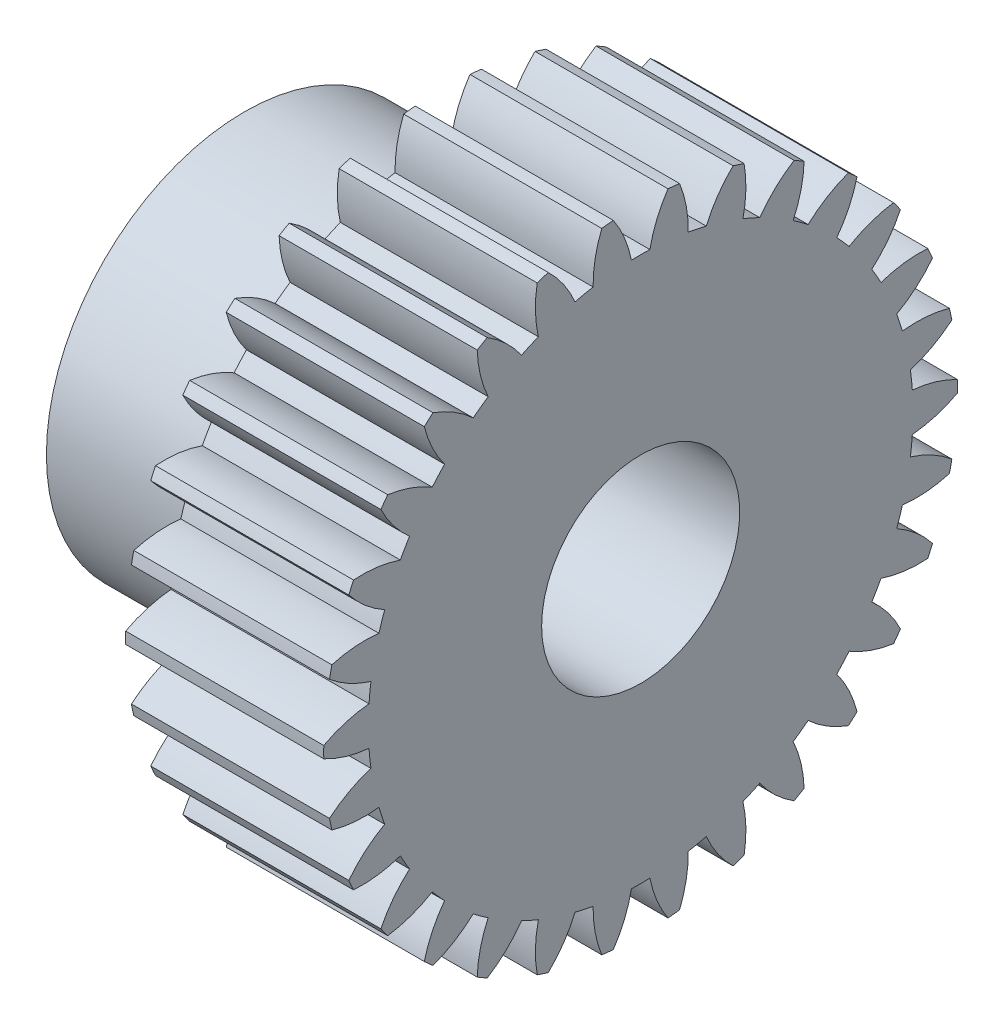
from build123d import *

# Parameters (mm, degrees)
BASPROSKE_W      = 5
BASPROSKE_H      = 8
TOOTHCUT_DEPTH   = 13.369316877
TEETHCUTS_COUNT  = 30
TEETHCUTS_ANGLE  = 348
HUBNEAONESKE_R   = 5
HUBNEARONE_DEPTH = 5.0000508
BORSKE_R         = 2.5
BORE_DEPTH       = 10.0000508


with BuildPart() as part:
    # BasProSke → Base-Revolve (revolve)
    with BuildSketch(Plane(origin=(0, 0, 0), x_dir=(1, 0, 0), z_dir=(0, 1, 0)), mode=Mode.PRIVATE) as base_revolve_sk:
        with Locations((2.5, 4)):
            Rectangle(BASPROSKE_W, BASPROSKE_H)
    revolve(base_revolve_sk.sketch.rotate(Axis((-10, 0, 0), (1, 0, 0)), 180), axis=Axis((-10, 0, 0), (1, 0, 0)))

    # TooCutSke → ToothCut (cut, through all)
    with BuildSketch(Plane(origin=(0, 0, 0), x_dir=(0, 0, -1), z_dir=(1, 0, 0))):
        with BuildLine():
            ThreePointArc((0.233102578, 6.87004652), (0, 6.874), (-0.233102578, 6.87004652))
            ThreePointArc((-0.233102578, 6.87004652), (-0.41229689, 7.456465027), (-0.706981715, 7.994199273))
            ThreePointArc((-0.706981715, 7.994199273), (0, 8.0254), (0.706981715, 7.994199273))
            ThreePointArc((0.706981715, 7.994199273), (0.41229689, 7.456465027), (0.233102578, 6.87004652))
        make_face()
    toothcut = extrude(amount=TOOTHCUT_DEPTH, mode=Mode.SUBTRACT)

    # TeethCuts: ToothCut ×30 about axis
    teethcuts_axis = Axis((-10, 0, 0), (1, 0, 0))
    for i in range(1, TEETHCUTS_COUNT):
        add(toothcut.rotate(teethcuts_axis, i * TEETHCUTS_ANGLE / (TEETHCUTS_COUNT - 1)), mode=Mode.SUBTRACT)

    # HubNeaOneSke → HubNearOne (add)
    with BuildSketch(Plane.ZY):
        with Locations(Location((0, 0, 0), (0, 0, 180))):
            Circle(HUBNEAONESKE_R)
    extrude(amount=HUBNEARONE_DEPTH)

    # BorSke → Bore (cut, symmetric)
    with BuildSketch(Plane(origin=(0, 0, 0), x_dir=(0, 0, -1), z_dir=(1, 0, 0))):
        with Locations(Location((0, 0, 0), (0, 0, 180))):
            Circle(BORSKE_R)
    extrude(amount=BORE_DEPTH, both=True, mode=Mode.SUBTRACT)


solid = part.part
